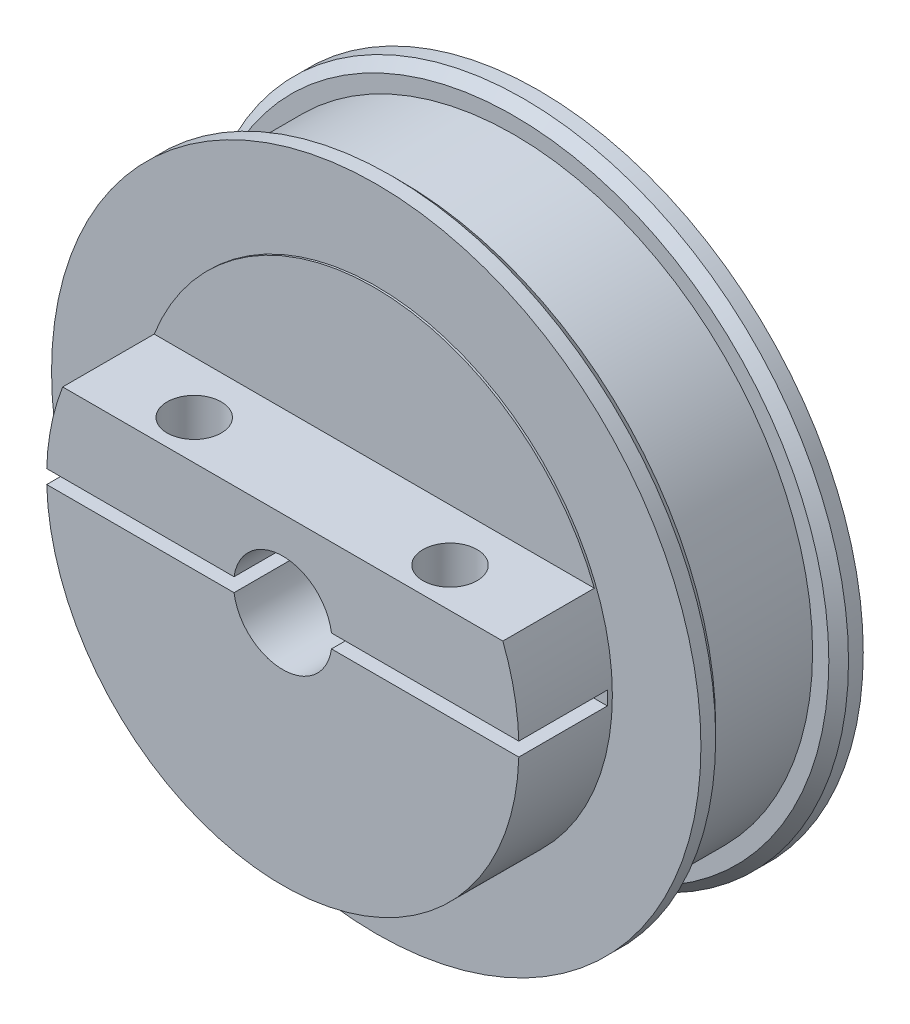
from build123d import *

# Parameters (mm, degrees)
SKETCH_1_R          = 33
EXTRUDE_1_DEPTH     = 2.5
SKETCH_2_R          = 30.35
EXTRUDE_2_DEPTH     = 11.5
SKETCH_3_R          = 33
EXTRUDE_3_DEPTH     = 2.5
SKETCH_4_R          = 24
EXTRUDE_4_DEPTH     = 9.5
CHAMFER_1_SIZE      = 1
SKETCH_5_R          = 5
CUT_EXTRUDE_1_DEPTH = 54.422841557
SKETCH_6_W          = 50
SKETCH_6_H          = 1.4
CUT_EXTRUDE_2_DEPTH = 9
SKETCH_7_R          = 2.75
CUT_EXTRUDE_3_DEPTH = 8
SKETCH_8_R          = 5
CUT_EXTRUDE_4_DEPTH = 60.193665202
HOLE_WIZARD_M5_1_D  = 4.2
SKETCH_12_W         = 10
SKETCH_12_H         = 14
CUT_EXTRUDE_5_DEPTH = 4
SKETCH_13_W         = 72.487869612
SKETCH_13_H         = 16.576438216
CUT_EXTRUDE_6_DEPTH = 9.3


with BuildPart() as part:
    # 草图1 → 凸台-拉伸1 (new body)
    with BuildSketch(Plane.XY):
        Circle(SKETCH_1_R)
    extrude(amount=EXTRUDE_1_DEPTH)

    # 草图2 → 凸台-拉伸2 (add)
    with BuildSketch(Plane.XY.offset(2.5)):
        Circle(SKETCH_2_R)
    extrude(amount=EXTRUDE_2_DEPTH)

    # 草图3 → 凸台-拉伸3 (add)
    with BuildSketch(Plane.XY.offset(14)):
        Circle(SKETCH_3_R)
    extrude(amount=EXTRUDE_3_DEPTH)

    # 草图4 → 凸台-拉伸4 (add)
    with BuildSketch(Plane.XY.offset(16.5)):
        Circle(SKETCH_4_R)
    extrude(amount=EXTRUDE_4_DEPTH)

    # 倒角1
    chamfer_1_edges = [part.edges().sort_by_distance(p)[0] for p in [
        (-33, 0, 2.5),
        (-33, 0, 14),
    ]]
    chamfer(chamfer_1_edges, length=CHAMFER_1_SIZE)

    # 草图5 → 切除-拉伸1 (cut, through all)
    with BuildSketch(Plane.XY.offset(26)):
        Circle(SKETCH_5_R)
    extrude(amount=-CUT_EXTRUDE_1_DEPTH, mode=Mode.SUBTRACT)

    # 草图6 → 切除-拉伸2 (cut)
    with BuildSketch(Plane.XY.offset(26)):
        Rectangle(SKETCH_6_W, SKETCH_6_H)
    extrude(amount=-CUT_EXTRUDE_2_DEPTH, mode=Mode.SUBTRACT)

    # 草图7 → 切除-拉伸3 (cut)
    with BuildSketch(Plane.XZ.offset(-0.7)):
        with Locations((-13, 22)):
            Circle(SKETCH_7_R)
        with Locations(Location((13, 22, 0), (0, 0, 180))):
            Circle(SKETCH_7_R)
    extrude(amount=-CUT_EXTRUDE_3_DEPTH, mode=Mode.SUBTRACT)

    # 草图8 → 切除-拉伸4 (cut, through all)
    with BuildSketch(Plane.XZ.offset(-8.7)):
        with Locations((-13, 22)):
            Circle(SKETCH_8_R)
        with Locations((13, 22)):
            Circle(SKETCH_8_R)
    extrude(amount=-CUT_EXTRUDE_4_DEPTH, mode=Mode.SUBTRACT)

    # M5 螺纹孔1 (through all)
    with Locations(Plane(origin=(0, -0.7, 0), x_dir=(-1, 0, 0), z_dir=(0, 1, 0))):
        with Locations((13, 22), (-13, 22)):
            Hole(HOLE_WIZARD_M5_1_D / 2)

    # 草图12 → 切除-拉伸5 (cut)
    with BuildSketch(Plane.XY.offset(26)):
        with Locations((-13, 15.7)):
            Rectangle(SKETCH_12_W, SKETCH_12_H)
        with Locations((13, 15.7)):
            Rectangle(SKETCH_12_W, SKETCH_12_H)
    extrude(amount=-CUT_EXTRUDE_5_DEPTH, mode=Mode.SUBTRACT)

    # 草图13 → 切除-拉伸6 (cut)
    with BuildSketch(Plane.XY.offset(26)):
        with Locations((-2.709766805, 16.988219108)):
            Rectangle(SKETCH_13_W, SKETCH_13_H)
    extrude(amount=-CUT_EXTRUDE_6_DEPTH, mode=Mode.SUBTRACT)


solid = part.part
